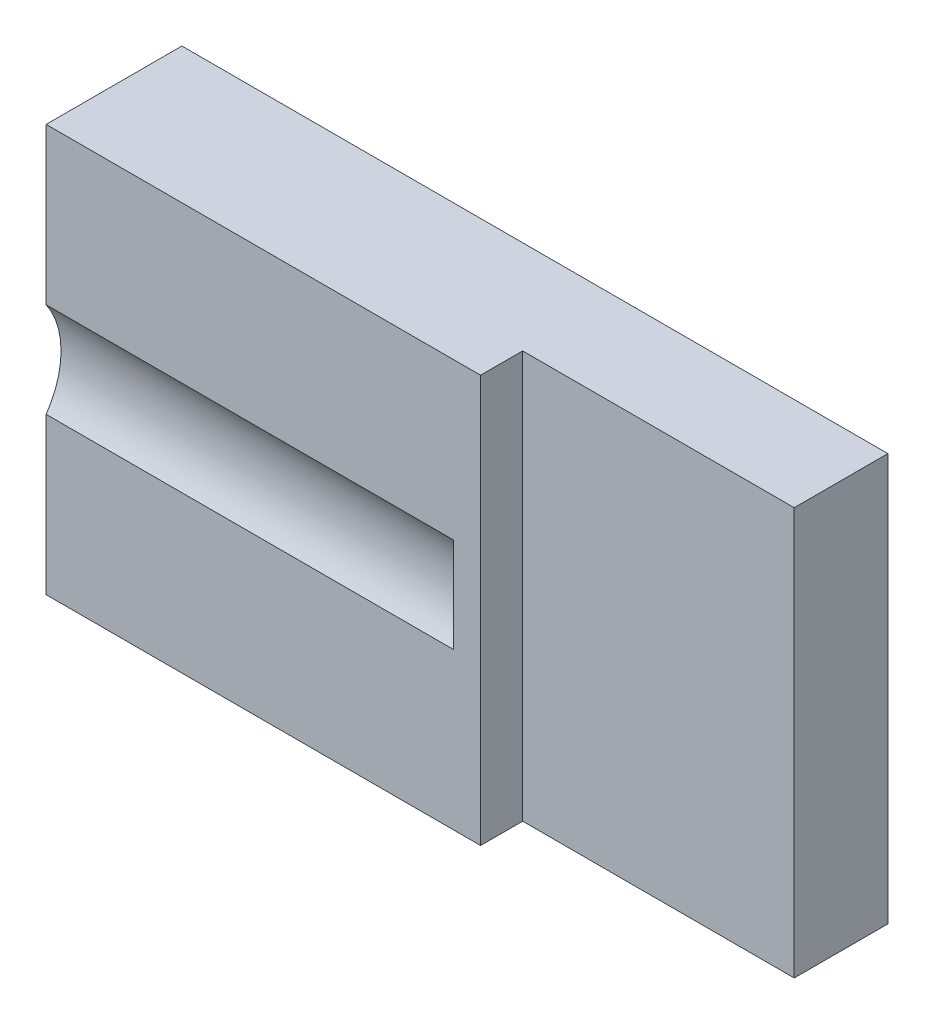
from build123d import *

# Parameters (mm, degrees)
SKIZZE1_W                       = 26
SKIZZE1_H                       = 15
AUFSATZ_LINEAR_AUSTRAGEN1_DEPTH = 5
SCHNITT_LINEAR_AUSTRAGEN1_DEPTH = 15
SKIZZE3_W                       = 10
SKIZZE3_H                       = 15
SCHNITT_LINEAR_AUSTRAGEN2_DEPTH = 1.55


with BuildPart() as part:
    # Skizze1 → Aufsatz-Linear austragen1 (new body)
    with BuildSketch(Plane.XY):
        with Locations((13, 7.5)):
            Rectangle(SKIZZE1_W, SKIZZE1_H)
    extrude(amount=AUFSATZ_LINEAR_AUSTRAGEN1_DEPTH)

    # Skizze2 → Schnitt-Linear austragen1 (cut)
    with BuildSketch(Plane.ZY):
        with BuildLine():
            Line((5, 9.247140521), (5, 5.752859479))
            ThreePointArc((5, 5.752859479), (4.45, 7.5), (5, 9.247140521))
        make_face()
    extrude(amount=-SCHNITT_LINEAR_AUSTRAGEN1_DEPTH, mode=Mode.SUBTRACT)

    # Skizze3 → Schnitt-Linear austragen2 (cut)
    with BuildSketch(Plane.XY.offset(5)):
        with Locations((21, 7.5)):
            Rectangle(SKIZZE3_W, SKIZZE3_H)
    extrude(amount=-SCHNITT_LINEAR_AUSTRAGEN2_DEPTH, mode=Mode.SUBTRACT)


solid = part.part
